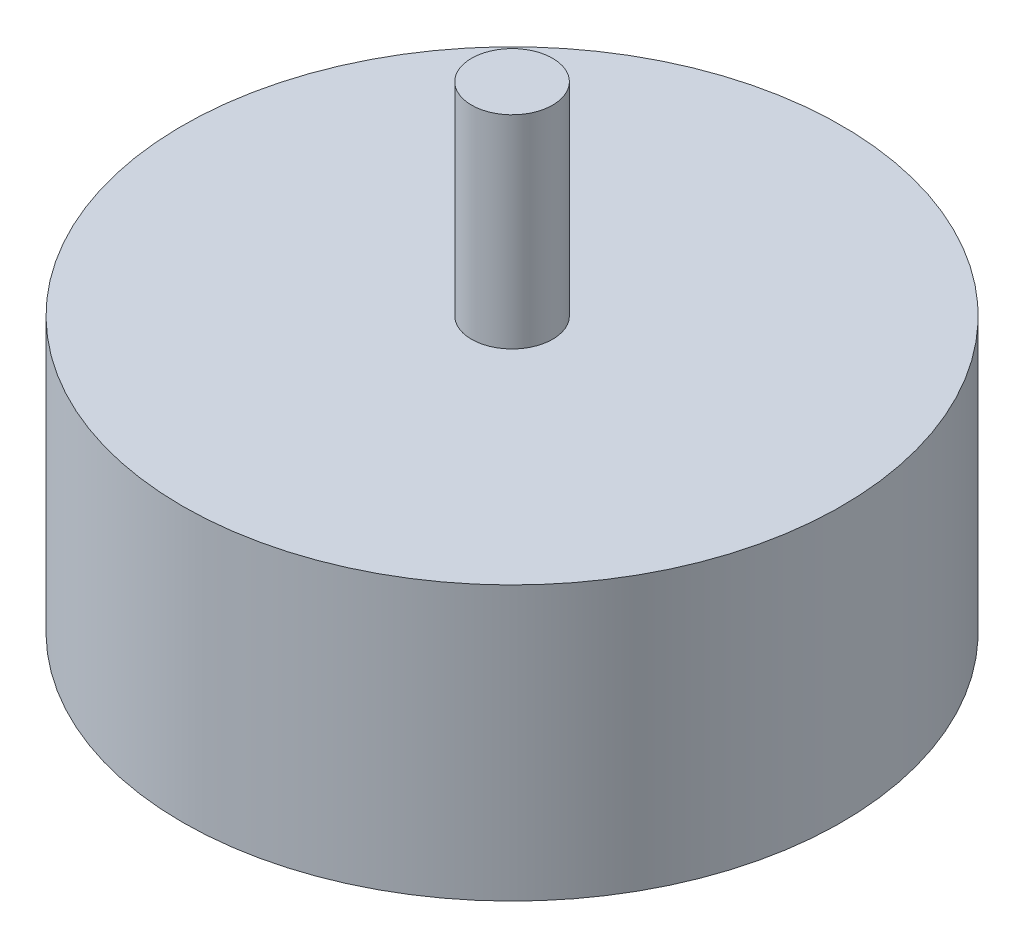
from build123d import *

# Parameters (mm, degrees)
SKETCH1_R           = 32.5
BOSS_EXTRUDE1_DEPTH = 27
SKETCH2_R           = 4
BOSS_EXTRUDE2_DEPTH = 20


with BuildPart() as part:
    # Sketch1 → Boss-Extrude1 (new body)
    with BuildSketch(Plane(origin=(0, 0, 0), x_dir=(1, 0, 0), z_dir=(0, 1, 0))):
        with Locations(Location((0, 0, 0), (0, 0, 270))):
            Circle(SKETCH1_R)
    extrude(amount=BOSS_EXTRUDE1_DEPTH)

    # Sketch2 → Boss-Extrude2 (add)
    with BuildSketch(Plane(origin=(0, 27, 0), x_dir=(1, 0, 0), z_dir=(0, 1, 0))):
        with Locations(Location((0, 0, 0), (0, 0, 270))):
            Circle(SKETCH2_R)
    extrude(amount=BOSS_EXTRUDE2_DEPTH)


solid = part.part
